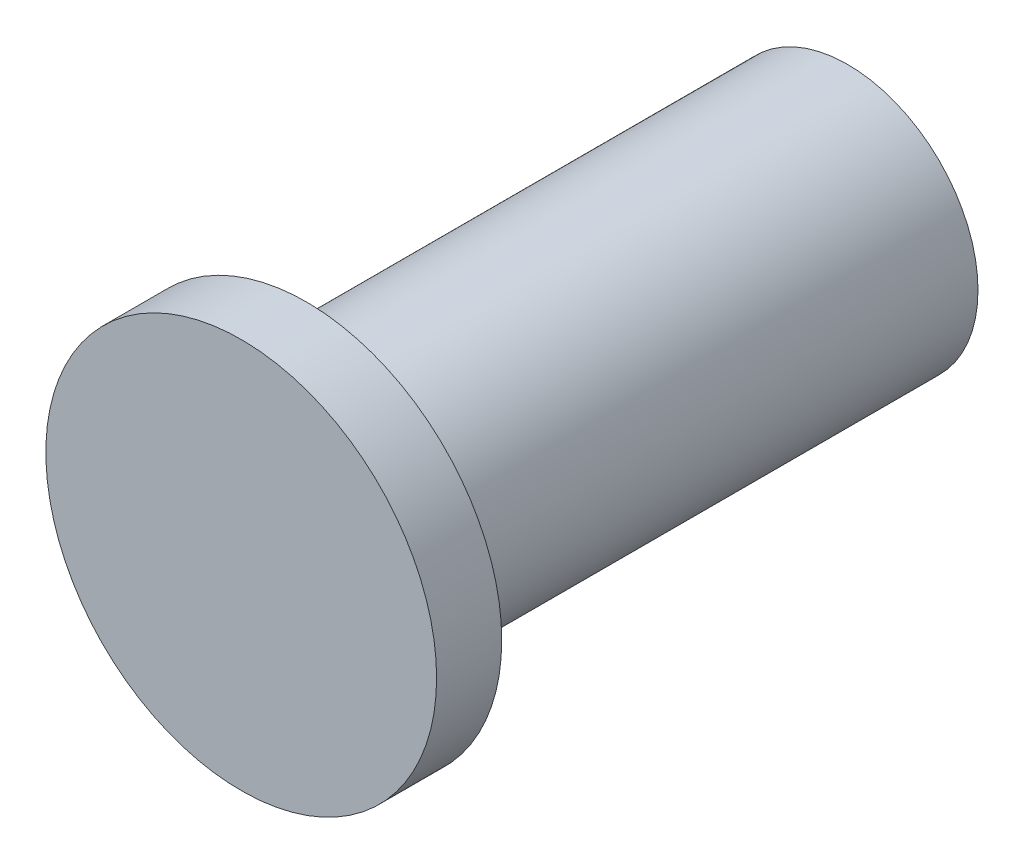
from build123d import *

# Parameters (mm, degrees)
BOSS_EXTRUDE4_DEPTH      = 16
BOSS_EXTRUDE4_DEPTH_BACK = 0.625401596
SKETCH2_R                = 4
SKETCH4_R                = 6
BOSS_EXTRUDE5_DEPTH      = 2
SKETCH5_R                = 3
CUT_EXTRUDE1_DEPTH       = 16


with BuildPart() as part:
    # Sketch2 → Boss-Extrude4 (new, two sides: drawn at the far end of the back side and taken through both)
    with BuildSketch(Plane.XY.offset(-BOSS_EXTRUDE4_DEPTH_BACK)):
        Circle(SKETCH2_R)
    extrude(amount=BOSS_EXTRUDE4_DEPTH + BOSS_EXTRUDE4_DEPTH_BACK)

    # Sketch4 → Boss-Extrude5 (add)
    with BuildSketch(Plane.XY.offset(16)):
        Circle(SKETCH4_R)
    extrude(amount=BOSS_EXTRUDE5_DEPTH)

    # Sketch5 → Cut-Extrude1 (cut)
    with BuildSketch(Plane(origin=(0, 0, -0.625401596), x_dir=(-1, 0, 0), z_dir=(0, 0, -1))):
        Circle(SKETCH5_R)
    extrude(amount=-CUT_EXTRUDE1_DEPTH, mode=Mode.SUBTRACT)


solid = part.part
